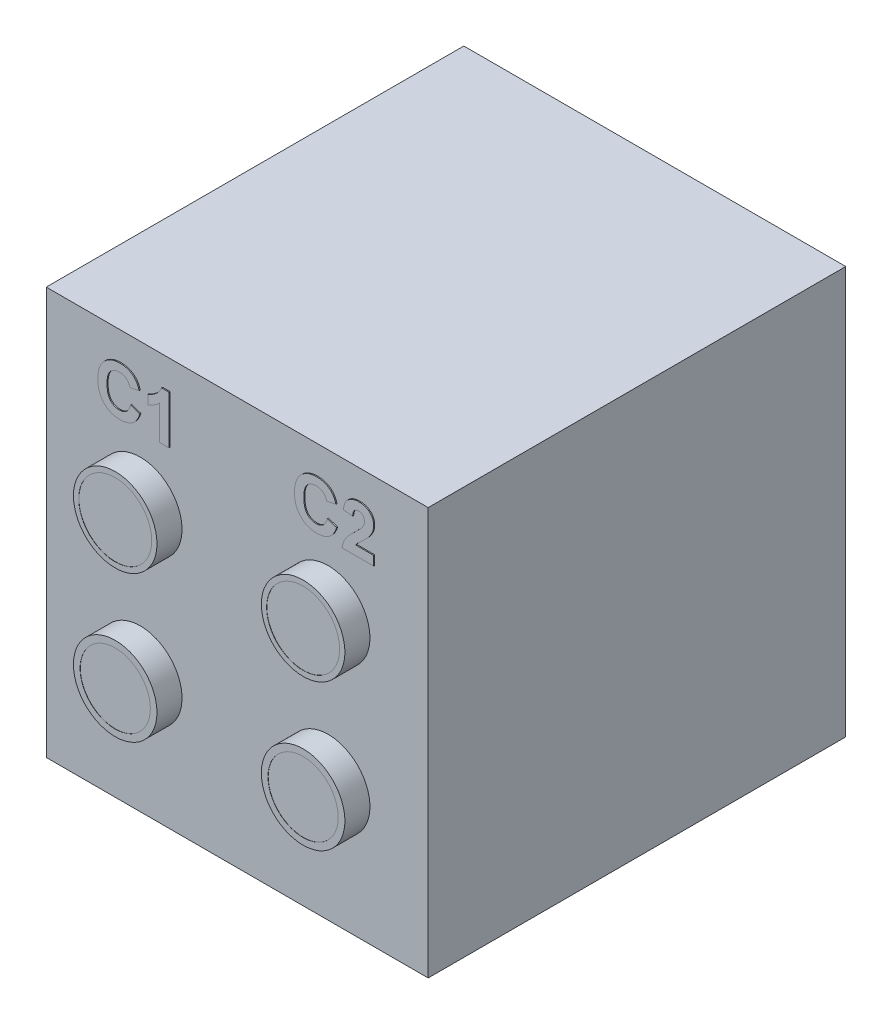
from build123d import *

# Parameters (mm, degrees)
CROQUIS1_W              = 400
CROQUIS1_H              = 500
SALIENTE_EXTRUIR1_DEPTH = 200
CROQUIS3_W              = 125
CROQUIS3_H              = 59
SALIENTE_EXTRUIR4_DEPTH = 30
REDONDEO1_R             = 6
REDONDEO2_R             = 3
CROQUIS4_R              = 10
SALIENTE_EXTRUIR5_DEPTH = 4
CHAFL_N1_SIZE           = 2
CROQUIS5_W              = 2.89106189
CROQUIS5_H              = 11.842268148
CORTAR_EXTRUIR1_DEPTH   = 0.1
CROQUIS6_R              = 20
SALIENTE_EXTRUIR6_DEPTH = 12
CROQUIS7_R              = 17.489444479
CROQUIS7_R_2            = 16.823196651
CORTAR_EXTRUIR2_DEPTH   = 0.1
CROQUIS8_W              = 125
CROQUIS8_H              = 59
SALIENTE_EXTRUIR7_DEPTH = 30
REDONDEO3_R             = 5
REDONDEO4_R             = 4
CROQUIS9_W              = 150.812994439
CROQUIS9_H              = 65.62344028
CORTAR_EXTRUIR3_DEPTH   = 30
CROQUIS10_W             = 177.8
CROQUIS10_H             = 100
SALIENTE_EXTRUIR8_DEPTH = 5
REDONDEO5_R             = 3
REDONDEO6_R             = 0.5
CROQUIS11_W             = 145.330042606
CROQUIS11_H             = 77.93999432
CORTAR_EXTRUIR4_DEPTH   = 2
CROQUIS12_W             = 154.511200307
CROQUIS12_H             = 64.586559633
CORTAR_EXTRUIR5_DEPTH   = 30
SALIENTE_EXTRUIR9_DEPTH = 0.5
CROQUIS15_W             = 743.222851548
CROQUIS15_H             = 911.06047989
CROQUIS15_W_2           = 182.932987454
CROQUIS15_H_2           = 195.128519951
CORTAR_EXTRUIR6_DEPTH   = 300


with BuildPart() as part:
    # Croquis1 → Saliente-Extruir1 (new body)
    with BuildSketch(Plane.XY):
        with Locations((200, 250)):
            Rectangle(CROQUIS1_W, CROQUIS1_H)
    extrude(amount=SALIENTE_EXTRUIR1_DEPTH)

    # Croquis3 → Saliente-Extruir4 (add)
    with BuildSketch(Plane.XY.offset(200)):
        with Locations((200, 470)):
            Rectangle(CROQUIS3_W, CROQUIS3_H)
    extrude(amount=SALIENTE_EXTRUIR4_DEPTH)

    # Redondeo1
    redondeo1_edges = [part.edges().sort_by_distance(p)[0] for p in [
        (262.5, 470, 230),
        (200, 499.5, 230),
        (137.5, 470, 230),
        (200, 440.5, 230),
    ]]
    fillet(redondeo1_edges, radius=REDONDEO1_R)

    # Redondeo2
    redondeo2_edges = [part.edges().sort_by_distance(p)[0] for p in [
        (262.5, 440.5, 212),
        (137.5, 440.5, 212),
        (262.5, 499.5, 212),
        (137.5, 499.5, 212),
        (139.623706555, 497.376293445, 228.579776101),
        (260.376293445, 497.376293445, 228.579776101),
        (139.623706555, 442.623706555, 228.579776101),
        (260.376293445, 442.623706555, 228.579776101),
    ]]
    fillet(redondeo2_edges, radius=REDONDEO2_R)

    # Croquis4 → Saliente-Extruir5 (add)
    with BuildSketch(Plane.XY.offset(200)):
        with Locations((25, 250)):
            Circle(CROQUIS4_R)
    extrude(amount=SALIENTE_EXTRUIR5_DEPTH)

    # Chaflán1
    chafl_n1_edges = [part.edges().sort_by_distance(p)[0] for p in [
        (15, 250, 204),
    ]]
    chamfer(chafl_n1_edges, length=CHAFL_N1_SIZE)

    # Croquis5 → Cortar-Extruir1 (cut)
    with BuildSketch(Plane.XY.offset(204)):
        with Locations((25, 250)):
            Rectangle(CROQUIS5_W, CROQUIS5_H)
    extrude(amount=-CORTAR_EXTRUIR1_DEPTH, mode=Mode.SUBTRACT)

    # Croquis6 → Saliente-Extruir6 (add)
    with BuildSketch(Plane.XY.offset(200)):
        with Locations(Location((66.83774854, 164.048551202, 0), (0, 0, 180))):
            Circle(CROQUIS6_R)
        with Locations(Location((66.83774854, 94.048551202, 0), (0, 0, 180))):
            Circle(CROQUIS6_R)
        with Locations(Location((156.83774854, 94.048551202, 0), (0, 0, 180))):
            Circle(CROQUIS6_R)
        with Locations(Location((156.83774854, 164.048551202, 0), (0, 0, 180))):
            Circle(CROQUIS6_R)
    extrude(amount=SALIENTE_EXTRUIR6_DEPTH)

    # Croquis7 → Cortar-Extruir2 (cut)
    with BuildSketch(Plane.XY.offset(212)):
        with Locations((66.83774854, 164.048551202)):
            Circle(CROQUIS7_R)
        with Locations((66.83774854, 94.048551202)):
            Circle(CROQUIS7_R_2)
        with Locations(Location((156.83774854, 94.048551202, 0), (0, 0, 180))):
            Circle(CROQUIS7_R_2)
        with Locations(Location((156.83774854, 164.048551202, 0), (0, 0, 180))):
            Circle(CROQUIS7_R)
    extrude(amount=-CORTAR_EXTRUIR2_DEPTH, mode=Mode.SUBTRACT)

    # Croquis8 → Saliente-Extruir7 (add)
    with BuildSketch(Plane.ZY):
        with Locations((100, 470)):
            Rectangle(CROQUIS8_W, CROQUIS8_H)
    extrude(amount=SALIENTE_EXTRUIR7_DEPTH)

    # Redondeo3
    redondeo3_edges = [part.edges().sort_by_distance(p)[0] for p in [
        (-30, 470, 162.5),
        (-30, 499.5, 100),
        (-30, 470, 37.5),
        (-30, 440.5, 100),
    ]]
    fillet(redondeo3_edges, radius=REDONDEO3_R)

    # Redondeo4
    redondeo4_edges = [part.edges().sort_by_distance(p)[0] for p in [
        (-12.5, 440.5, 162.5),
        (-12.5, 440.5, 37.5),
        (-12.5, 499.5, 162.5),
        (-12.5, 499.5, 37.5),
        (-28.816480084, 497.730244537, 39.269755463),
        (-28.816480084, 497.730244537, 160.730244537),
        (-28.816480084, 442.269755463, 39.269755463),
        (-28.816480084, 442.269755463, 160.730244537),
    ]]
    fillet(redondeo4_edges, radius=REDONDEO4_R)

    # Croquis9 → Cortar-Extruir3 (cut)
    with BuildSketch(Plane.XY.offset(230)):
        with Locations((199.746817996, 467.18827986)):
            Rectangle(CROQUIS9_W, CROQUIS9_H)
    extrude(amount=-CORTAR_EXTRUIR3_DEPTH, mode=Mode.SUBTRACT)

    # Croquis10 → Saliente-Extruir8 (add)
    with BuildSketch(Plane.XY.offset(200)):
        with Locations((261.1, 370)):
            Rectangle(CROQUIS10_W, CROQUIS10_H)
    extrude(amount=SALIENTE_EXTRUIR8_DEPTH)

    # Redondeo5
    redondeo5_edges = [part.edges().sort_by_distance(p)[0] for p in [
        (172.2, 420, 202.5),
        (172.2, 320, 202.5),
        (350, 320, 202.5),
        (350, 420, 202.5),
    ]]
    fillet(redondeo5_edges, radius=REDONDEO5_R)

    # Redondeo6
    redondeo6_edges = [part.edges().sort_by_distance(p)[0] for p in [
        (350, 370, 205),
        (261.1, 320, 205),
        (172.2, 370, 205),
        (261.1, 420, 205),
        (173.078679656, 419.121320344, 205),
        (173.078679656, 320.878679656, 205),
        (349.121320344, 419.121320344, 205),
        (349.121320344, 320.878679656, 205),
    ]]
    fillet(redondeo6_edges, radius=REDONDEO6_R)

    # Croquis11 → Cortar-Extruir4 (cut)
    with BuildSketch(Plane.XY.offset(205)):
        with Locations((261.1, 370)):
            Rectangle(CROQUIS11_W, CROQUIS11_H)
    extrude(amount=-CORTAR_EXTRUIR4_DEPTH, mode=Mode.SUBTRACT)

    # Croquis12 → Cortar-Extruir5 (cut)
    with BuildSketch(Plane.ZY.offset(30)):
        with Locations((101.786058174, 467.706720184)):
            Rectangle(CROQUIS12_W, CROQUIS12_H)
    extrude(amount=-CORTAR_EXTRUIR5_DEPTH, mode=Mode.SUBTRACT)

    # Croquis14 → Saliente-Extruir9 (add)
    with BuildSketch(Plane.XY.offset(200)):
        with BuildLine():
            Line((62.676778585, 203.812745701), (67.12194554, 202.331023382))
            add(Edge.make_bspline(
                [(67.12194554, 202.331023382), (67.031606065, 202.039564983), (66.854692956, 201.468797751), (66.529850829, 200.65075278), (66.158398895, 199.892633211), (65.753695386, 199.185565757), (65.290572591, 198.547816261), (64.794958583, 197.958269219), (64.25211678, 197.429341617), (63.664725712, 196.959904), (63.038439348, 196.544770101), (62.365982703, 196.193819856), (61.657391242, 195.891555504), (60.905479447, 195.646657651), (60.11523751, 195.450531644), (59.282957564, 195.32098935), (58.412532929, 195.233155396), (57.818194482, 195.223632057), (57.513902383, 195.218756255)],
                knots=[0, 0, 0, 0, 1.126640671, 2.206316847, 3.246446654, 4.24268115, 5.210795778, 6.153057602, 7.084219323, 8.004711971, 8.926421631, 9.854560063, 10.802134612, 11.768317461, 12.772025444, 13.805668576, 14.876536225, 16, 16, 16, 16], degree=3))
            add(Edge.make_bspline(
                [(57.513902383, 195.218756255), (57.138315965, 195.226522568), (56.39952625, 195.241799136), (55.319116268, 195.395578895), (54.289534407, 195.63551199), (53.309307786, 195.967695186), (52.384979279, 196.407670986), (51.508115862, 196.93734481), (50.685099031, 197.567469897), (49.918816065, 198.287426209), (49.222629464, 199.091717663), (48.620608156, 199.975998097), (48.106201766, 200.927810146), (47.690432, 201.951692163), (47.365328098, 203.046592798), (47.137592141, 204.210998176), (46.995089461, 205.445275086), (46.978854243, 206.291141154), (46.970522012, 206.725256132)],
                knots=[0, 0, 0, 0, 1.025049111, 2.016302254, 2.973197159, 3.90886983, 4.83646737, 5.763135642, 6.70136783, 7.661478232, 8.629732022, 9.600038443, 10.576877021, 11.5787097, 12.612181225, 13.690866959, 14.814907849, 16, 16, 16, 16], degree=3))
            add(Edge.make_bspline(
                [(46.970522012, 206.725256132), (46.978816686, 207.182516941), (46.994998081, 208.074549345), (47.137767723, 209.371488092), (47.359409088, 210.593777254), (47.68506246, 211.733838151), (48.094722426, 212.799694139), (48.609753359, 213.780764547), (49.205769523, 214.690129724), (49.898796493, 215.511122125), (50.668571701, 216.240052361), (51.493481044, 216.884623754), (52.381220187, 217.425372939), (53.326931221, 217.867569327), (54.331882511, 218.209762654), (55.394096587, 218.456168709), (56.514442527, 218.599592877), (57.280428607, 218.619705023), (57.671335379, 218.629968883)],
                knots=[0, 0, 0, 0, 1.212648312, 2.365655595, 3.457000981, 4.504219827, 5.506356588, 6.480637568, 7.437950897, 8.385265166, 9.323599949, 10.245787653, 11.157260172, 12.074946661, 13.00980897, 13.968233668, 14.963125779, 16, 16, 16, 16], degree=3))
            add(Edge.make_bspline(
                [(57.671335379, 218.629968883), (58.012729369, 218.62136664), (58.682077718, 218.604500797), (59.662270407, 218.489913642), (60.591218768, 218.288820835), (61.473944067, 218.017390262), (62.305421347, 217.659174112), (63.087140196, 217.221437665), (63.821787572, 216.706496998), (64.26442774, 216.304267347), (64.487258043, 216.101780177)],
                knots=[0, 0, 0, 0, 1.098510076, 2.153775193, 3.169777012, 4.153122333, 5.120892526, 6.076995459, 7.031936742, 8, 8, 8, 8], degree=3))
            add(Edge.make_bspline(
                [(64.487258043, 216.101780177), (64.616407561, 215.972935535), (64.877740225, 215.712219784), (65.226692682, 215.272057722), (65.557542963, 214.798223188), (65.865039813, 214.282633169), (66.139464605, 213.72139135), (66.394022911, 213.123116617), (66.628385193, 212.485502824), (66.758717573, 212.041763021), (66.825601076, 211.814046219)],
                knots=[0, 0, 0, 0, 0.885292881, 1.791380647, 2.722937556, 3.69093542, 4.703306561, 5.754477758, 6.847650944, 8, 8, 8, 8], degree=3))
            Line((66.825601076, 211.814046219), (62.380434121, 210.925012828))
            add(Edge.make_bspline(
                [(62.380434121, 210.925012828), (62.34265203, 211.070814562), (62.268231221, 211.358005725), (62.117650843, 211.770683654), (61.944923276, 212.162278152), (61.730843276, 212.523197703), (61.503434958, 212.869498601), (61.23419634, 213.185804011), (60.940321951, 213.480403605), (60.619694763, 213.750240154), (60.276137111, 213.989861194), (59.9162637, 214.205265586), (59.533533682, 214.381102877), (59.133038309, 214.523354833), (58.71637272, 214.642622381), (58.279827314, 214.716299503), (57.827151504, 214.772859722), (57.518727437, 214.775924517), (57.361099768, 214.777490855)],
                knots=[0, 0, 0, 0, 1.051226935, 2.070641259, 3.064374968, 4.034983734, 4.997599858, 5.953980297, 6.92954377, 7.901109626, 8.875958313, 9.851998019, 10.826131395, 11.811470594, 12.818270757, 13.847890818, 14.900111925, 16, 16, 16, 16], degree=3))
            add(Edge.make_bspline(
                [(57.361099768, 214.777490855), (57.144627398, 214.7731191), (56.722138103, 214.764586742), (56.104605268, 214.669456724), (55.516026291, 214.536692941), (54.958774875, 214.33396333), (54.436301936, 214.074673834), (53.942669536, 213.759478458), (53.480586993, 213.389727259), (53.049898132, 212.961039905), (52.663413419, 212.465665517), (52.32363819, 211.902581323), (52.04176418, 211.2653945), (51.812927309, 210.56035785), (51.632806623, 209.785794795), (51.504186272, 208.940711909), (51.433055352, 208.024531078), (51.421602676, 207.390607242), (51.415688967, 207.063274036)],
                knots=[0, 0, 0, 0, 0.938194206, 1.831074359, 2.704771284, 3.551924377, 4.396294915, 5.230222094, 6.087631332, 6.958733431, 7.860107878, 8.806247581, 9.804197948, 10.875520245, 12.017191412, 13.250061517, 14.580040491, 16, 16, 16, 16], degree=3))
            add(Edge.make_bspline(
                [(51.415688967, 207.063274036), (51.421544445, 206.71588301), (51.43282705, 206.046514012), (51.503942879, 205.081011143), (51.633385697, 204.193003924), (51.811112584, 203.380916456), (52.041102647, 202.645246149), (52.322499979, 201.987266071), (52.657027706, 201.40620565), (53.044165371, 200.902451804), (53.474125473, 200.469728804), (53.935262867, 200.097685545), (54.424856935, 199.779590027), (54.945853836, 199.517881543), (55.500235163, 199.319901988), (56.083444718, 199.176323743), (56.697622393, 199.085048771), (57.118449267, 199.075903651), (57.333317475, 199.071234282)],
                knots=[0, 0, 0, 0, 1.475208372, 2.842499301, 4.107722225, 5.282836115, 6.369007568, 7.375918121, 8.315702116, 9.208439171, 10.065831443, 10.90006451, 11.71996243, 12.54067204, 13.369972975, 14.214060185, 15.088124569, 16, 16, 16, 16], degree=3))
            add(Edge.make_bspline(
                [(57.333317475, 199.071234282), (57.492398058, 199.075203091), (57.805206406, 199.083007165), (58.267561262, 199.132539025), (58.711327629, 199.227063438), (59.138677604, 199.352054867), (59.551271578, 199.508882238), (59.942816146, 199.710060218), (60.32101477, 199.94128443), (60.678020134, 200.212261488), (61.018612719, 200.516484974), (61.329253367, 200.868091502), (61.617398356, 201.258632765), (61.879392136, 201.690718755), (62.12398875, 202.160650975), (62.332092794, 202.67575122), (62.525960364, 203.227695229), (62.625627768, 203.614322661), (62.676778585, 203.812745701)],
                knots=[0, 0, 0, 0, 0.980177776, 1.927374078, 2.859849964, 3.771585772, 4.668674471, 5.574490016, 6.479656464, 7.396337719, 8.332153134, 9.288470092, 10.28125149, 11.318486971, 12.398724812, 13.541284404, 14.738150009, 16, 16, 16, 16], degree=3))
        make_face()
        with BuildLine():
            Line((81.050135331, 195.218756255), (76.604968376, 195.218756255))
            Line((76.604968376, 195.218756255), (76.604968376, 211.675134752))
            add(Edge.make_bspline(
                [(76.604968376, 211.675134752), (76.403489531, 211.470596138), (76.003265116, 211.064293697), (75.364043677, 210.497555969), (74.700434368, 209.970340455), (74.005870166, 209.487654741), (73.289430799, 209.042621402), (72.543794663, 208.638751931), (71.774366386, 208.270458218), (71.241350104, 208.06463924), (70.974423567, 207.961568192)],
                knots=[0, 0, 0, 0, 1.012567276, 2.011397996, 3.011400399, 4.000747768, 4.993445519, 5.985067596, 6.990952157, 8, 8, 8, 8], degree=3))
            Line((70.974423567, 207.961568192), (70.974423567, 212.406735146))
            add(Edge.make_bspline(
                [(70.974423567, 212.406735146), (71.270458535, 212.517735556), (71.890036693, 212.750050777), (72.804325695, 213.244197029), (73.758636923, 213.855999945), (74.56031283, 214.456036922), (75.196810545, 214.989517748), (75.641674058, 215.418352623), (76.053865682, 215.85750178), (76.417891952, 216.321139343), (76.743308732, 216.799891585), (77.031642186, 217.292976379), (77.285441906, 217.80195135), (77.418304284, 218.156390229), (77.484741003, 218.333624419)],
                knots=[0, 0, 0, 0, 1.253673617, 2.623841347, 4.114270668, 5.751233548, 6.594491912, 7.409089316, 8.202422231, 8.983165545, 9.746111525, 10.498431446, 11.249153235, 12, 12, 12, 12], degree=3))
            Line((77.484741003, 218.333624419), (81.050135331, 218.333624419))
            Line((81.050135331, 218.333624419), (81.050135331, 195.218756255))
        make_face()
        with BuildLine():
            Line((156.914318023, 203.812745701), (161.359484978, 202.331023382))
            add(Edge.make_bspline(
                [(161.359484978, 202.331023382), (161.269145503, 202.039564983), (161.092232394, 201.468797751), (160.767390267, 200.65075278), (160.395938333, 199.892633211), (159.991234824, 199.185565757), (159.52811203, 198.547816261), (159.032498021, 197.958269219), (158.489656218, 197.429341617), (157.90226515, 196.959904), (157.275978786, 196.544770101), (156.603522141, 196.193819856), (155.89493068, 195.891555504), (155.143018885, 195.646657651), (154.352776948, 195.450531644), (153.520497002, 195.32098935), (152.650072367, 195.233155396), (152.05573392, 195.223632057), (151.751441821, 195.218756255)],
                knots=[0, 0, 0, 0, 1.126640671, 2.206316847, 3.246446654, 4.24268115, 5.210795778, 6.153057602, 7.084219323, 8.004711971, 8.926421631, 9.854560063, 10.802134612, 11.768317461, 12.772025444, 13.805668576, 14.876536225, 16, 16, 16, 16], degree=3))
            add(Edge.make_bspline(
                [(151.751441821, 195.218756255), (151.375855403, 195.226522568), (150.637065688, 195.241799136), (149.556655706, 195.395578895), (148.527073845, 195.63551199), (147.546847224, 195.967695186), (146.622518717, 196.407670986), (145.7456553, 196.93734481), (144.922638469, 197.567469897), (144.156355503, 198.287426209), (143.460168902, 199.091717663), (142.858147594, 199.975998097), (142.343741205, 200.927810146), (141.927971438, 201.951692163), (141.602867537, 203.046592798), (141.375131579, 204.210998176), (141.232628899, 205.445275086), (141.216393681, 206.291141154), (141.20806145, 206.725256132)],
                knots=[0, 0, 0, 0, 1.025049111, 2.016302254, 2.973197159, 3.90886983, 4.83646737, 5.763135642, 6.70136783, 7.661478232, 8.629732022, 9.600038443, 10.576877021, 11.5787097, 12.612181225, 13.690866959, 14.814907849, 16, 16, 16, 16], degree=3))
            add(Edge.make_bspline(
                [(141.20806145, 206.725256132), (141.216356124, 207.182516941), (141.232537519, 208.074549345), (141.375307161, 209.371488092), (141.596948526, 210.593777254), (141.922601898, 211.733838151), (142.332261864, 212.799694139), (142.847292797, 213.780764547), (143.443308961, 214.690129724), (144.136335931, 215.511122125), (144.906111139, 216.240052361), (145.731020482, 216.884623754), (146.618759625, 217.425372939), (147.564470659, 217.867569327), (148.569421949, 218.209762654), (149.631636025, 218.456168709), (150.751981966, 218.599592877), (151.517968045, 218.619705023), (151.908874817, 218.629968883)],
                knots=[0, 0, 0, 0, 1.212648312, 2.365655595, 3.457000981, 4.504219827, 5.506356588, 6.480637568, 7.437950897, 8.385265166, 9.323599949, 10.245787653, 11.157260172, 12.074946661, 13.00980897, 13.968233668, 14.963125779, 16, 16, 16, 16], degree=3))
            add(Edge.make_bspline(
                [(151.908874817, 218.629968883), (152.250268807, 218.62136664), (152.919617157, 218.604500797), (153.899809846, 218.489913642), (154.828758206, 218.288820835), (155.711483505, 218.017390262), (156.542960785, 217.659174112), (157.324679634, 217.221437665), (158.05932701, 216.706496998), (158.501967178, 216.304267347), (158.724797481, 216.101780177)],
                knots=[0, 0, 0, 0, 1.098510076, 2.153775193, 3.169777012, 4.153122333, 5.120892526, 6.076995459, 7.031936742, 8, 8, 8, 8], degree=3))
            add(Edge.make_bspline(
                [(158.724797481, 216.101780177), (158.853946999, 215.972935535), (159.115279663, 215.712219784), (159.46423212, 215.272057722), (159.795082401, 214.798223188), (160.102579251, 214.282633169), (160.377004043, 213.72139135), (160.631562349, 213.123116617), (160.865924632, 212.485502824), (160.996257011, 212.041763021), (161.063140514, 211.814046219)],
                knots=[0, 0, 0, 0, 0.885292881, 1.791380647, 2.722937556, 3.69093542, 4.703306561, 5.754477758, 6.847650944, 8, 8, 8, 8], degree=3))
            Line((161.063140514, 211.814046219), (156.617973559, 210.925012828))
            add(Edge.make_bspline(
                [(156.617973559, 210.925012828), (156.580191468, 211.070814562), (156.505770659, 211.358005725), (156.355190281, 211.770683654), (156.182462714, 212.162278152), (155.968382714, 212.523197703), (155.740974396, 212.869498601), (155.471735779, 213.185804011), (155.177861389, 213.480403605), (154.857234201, 213.750240154), (154.513676549, 213.989861194), (154.153803138, 214.205265586), (153.77107312, 214.381102877), (153.370577747, 214.523354833), (152.953912158, 214.642622381), (152.517366752, 214.716299503), (152.064690942, 214.772859722), (151.756266875, 214.775924517), (151.598639207, 214.777490855)],
                knots=[0, 0, 0, 0, 1.051226935, 2.070641259, 3.064374968, 4.034983734, 4.997599858, 5.953980297, 6.92954377, 7.901109626, 8.875958313, 9.851998019, 10.826131395, 11.811470594, 12.818270757, 13.847890818, 14.900111925, 16, 16, 16, 16], degree=3))
            add(Edge.make_bspline(
                [(151.598639207, 214.777490855), (151.382166836, 214.7731191), (150.959677542, 214.764586742), (150.342144706, 214.669456724), (149.753565729, 214.536692941), (149.196314313, 214.33396333), (148.673841374, 214.074673834), (148.180208974, 213.759478458), (147.718126431, 213.389727259), (147.28743757, 212.961039905), (146.900952857, 212.465665517), (146.561177628, 211.902581323), (146.279303618, 211.2653945), (146.050466748, 210.56035785), (145.870346061, 209.785794795), (145.74172571, 208.940711909), (145.67059479, 208.024531078), (145.659142114, 207.390607242), (145.653228405, 207.063274036)],
                knots=[0, 0, 0, 0, 0.938194206, 1.831074359, 2.704771284, 3.551924377, 4.396294915, 5.230222094, 6.087631332, 6.958733431, 7.860107878, 8.806247581, 9.804197948, 10.875520245, 12.017191412, 13.250061517, 14.580040491, 16, 16, 16, 16], degree=3))
            add(Edge.make_bspline(
                [(145.653228405, 207.063274036), (145.659083883, 206.71588301), (145.670366488, 206.046514012), (145.741482317, 205.081011143), (145.870925135, 204.193003924), (146.048652022, 203.380916456), (146.278642085, 202.645246149), (146.560039417, 201.987266071), (146.894567144, 201.40620565), (147.281704809, 200.902451804), (147.711664911, 200.469728804), (148.172802305, 200.097685545), (148.662396373, 199.779590027), (149.183393275, 199.517881543), (149.737774601, 199.319901988), (150.320984156, 199.176323743), (150.935161831, 199.085048771), (151.355988705, 199.075903651), (151.570856913, 199.071234282)],
                knots=[0, 0, 0, 0, 1.475208372, 2.842499301, 4.107722225, 5.282836115, 6.369007568, 7.375918121, 8.315702116, 9.208439171, 10.065831443, 10.90006451, 11.71996243, 12.54067204, 13.369972975, 14.214060185, 15.088124569, 16, 16, 16, 16], degree=3))
            add(Edge.make_bspline(
                [(151.570856913, 199.071234282), (151.729937496, 199.075203091), (152.042745844, 199.083007165), (152.505100701, 199.132539025), (152.948867067, 199.227063438), (153.376217042, 199.352054867), (153.788811017, 199.508882238), (154.180355584, 199.710060218), (154.558554208, 199.94128443), (154.915559572, 200.212261488), (155.256152157, 200.516484974), (155.566792805, 200.868091502), (155.854937794, 201.258632765), (156.116931574, 201.690718755), (156.361528188, 202.160650975), (156.569632232, 202.67575122), (156.763499802, 203.227695229), (156.863167206, 203.614322661), (156.914318023, 203.812745701)],
                knots=[0, 0, 0, 0, 0.980177776, 1.927374078, 2.859849964, 3.771585772, 4.668674471, 5.574490016, 6.479656464, 7.396337719, 8.332153134, 9.288470092, 10.28125149, 11.318486971, 12.398724812, 13.541284404, 14.738150009, 16, 16, 16, 16], degree=3))
        make_face()
        with BuildLine():
            Line((179.140152796, 199.66392321), (179.140152796, 195.218756255))
            Line((179.140152796, 195.218756255), (164.026585151, 195.218756255))
            add(Edge.make_bspline(
                [(164.026585151, 195.218756255), (164.077756189, 195.598660267), (164.180069573, 196.358255272), (164.496385979, 197.467832386), (164.918560031, 198.550590072), (165.376749776, 199.431692011), (165.832470229, 200.140948753), (166.245945421, 200.722119208), (166.739206143, 201.340459626), (167.305094649, 202.000961729), (167.940483607, 202.705690234), (168.650113428, 203.452025109), (169.437369156, 204.236393442), (169.991217583, 204.769018135), (170.27760118, 205.044427378)],
                knots=[0, 0, 0, 0, 1.156289446, 2.311930546, 3.473459201, 4.661751613, 5.303057008, 6.018253237, 6.81459331, 7.690699809, 8.644447906, 9.679642995, 10.800191253, 12, 12, 12, 12], degree=3))
            add(Edge.make_bspline(
                [(170.27760118, 205.044427378), (170.506138567, 205.265028524), (170.941206442, 205.684988134), (171.560743939, 206.286353274), (172.105381239, 206.839178771), (172.586505954, 207.329138546), (172.993003421, 207.768708214), (173.330220742, 208.150984403), (173.602428733, 208.47752386), (173.749856818, 208.684680695), (173.815213215, 208.776515467)],
                knots=[0, 0, 0, 0, 1.480720495, 2.818855715, 4.024636094, 5.098235712, 6.019786162, 6.815086302, 7.474715479, 8, 8, 8, 8], degree=3))
            add(Edge.make_bspline(
                [(173.815213215, 208.776515467), (173.949047166, 208.998827956), (174.20719735, 209.427642989), (174.490280443, 210.101962385), (174.660197468, 210.77614249), (174.683514681, 211.226625779), (174.694985842, 211.448246022)],
                knots=[0, 0, 0, 0, 1.0911822, 2.104764037, 3.067617678, 4, 4, 4, 4], degree=3))
            add(Edge.make_bspline(
                [(174.694985842, 211.448246022), (174.686660637, 211.678871681), (174.67091, 212.115197441), (174.538838186, 212.730933771), (174.304630255, 213.260246374), (173.982169035, 213.704759984), (173.574416175, 214.053034697), (173.097741225, 214.310375903), (172.545166428, 214.45265205), (172.156784262, 214.471365804), (171.953799553, 214.481146392)],
                knots=[0, 0, 0, 0, 1.193122327, 2.257294386, 3.237245624, 4.168877528, 5.075331632, 5.990371598, 6.949684428, 8, 8, 8, 8], degree=3))
            add(Edge.make_bspline(
                [(171.953799553, 214.481146392), (171.752186191, 214.472012054), (171.362712704, 214.454366485), (170.809186375, 214.300217214), (170.324952998, 214.03336861), (169.979862539, 213.729268884), (169.746737565, 213.433553988), (169.587894341, 213.175857936), (169.450983882, 212.883036195), (169.329669793, 212.558385447), (169.233845377, 212.198186478), (169.156674344, 211.805182565), (169.094485656, 211.377258789), (169.074708555, 211.079564465), (169.064441032, 210.925012828)],
                knots=[0, 0, 0, 0, 1.402788338, 2.709884207, 3.961032948, 5.225417836, 5.883680772, 6.578928686, 7.329201998, 8.132101139, 8.990263233, 9.922304639, 10.921339128, 12, 12, 12, 12], degree=3))
            Line((169.064441032, 210.925012828), (164.619274078, 211.360268759))
            add(Edge.make_bspline(
                [(164.619274078, 211.360268759), (164.655012532, 211.660373557), (164.724303684, 212.24222881), (164.897220915, 213.077973574), (165.11621418, 213.848985844), (165.391723627, 214.553834761), (165.712362116, 215.197002479), (166.094484878, 215.768837867), (166.524740138, 216.275675242), (167.003499735, 216.717244856), (167.527720037, 217.094951456), (168.077795182, 217.432112556), (168.664475175, 217.708691838), (169.281300651, 217.93663472), (169.927992855, 218.118804849), (170.607542825, 218.239253268), (171.315756633, 218.323977149), (171.799186334, 218.330360196), (172.046407198, 218.333624419)],
                knots=[0, 0, 0, 0, 1.270971563, 2.464210789, 3.586263665, 4.638946707, 5.643716971, 6.603612468, 7.52484387, 8.434700188, 9.336036235, 10.239171475, 11.145359471, 12.059630629, 13.003312604, 13.96741569, 14.960557767, 16, 16, 16, 16], degree=3))
            add(Edge.make_bspline(
                [(172.046407198, 218.333624419), (172.315168216, 218.328458972), (172.838614045, 218.318398615), (173.602752028, 218.235320108), (174.32060476, 218.090460693), (174.998448214, 217.898573896), (175.629321299, 217.642390992), (176.218481058, 217.332676513), (176.756655149, 216.957676168), (177.251865786, 216.537840321), (177.694544473, 216.076157016), (178.082290947, 215.583693718), (178.407143665, 215.060793523), (178.679744983, 214.513830005), (178.882149622, 213.934001731), (179.029630443, 213.329326136), (179.127416167, 212.696982279), (179.135860299, 212.265105769), (179.140152796, 212.045565331)],
                knots=[0, 0, 0, 0, 1.210756838, 2.35810096, 3.457354827, 4.507168606, 5.527358126, 6.519769748, 7.499700793, 8.476517721, 9.440526811, 10.376769937, 11.295256217, 12.209626307, 13.124630862, 14.055668209, 15.011616881, 16, 16, 16, 16], degree=3))
            add(Edge.make_bspline(
                [(179.140152796, 212.045565331), (179.134497489, 211.79360266), (179.123278226, 211.293747386), (179.015862112, 210.554811958), (178.851751202, 209.832916287), (178.609208199, 209.126296129), (178.301766114, 208.418001303), (177.905465895, 207.706441979), (177.445331368, 206.97015879), (177.08506417, 206.49411958), (176.89904779, 206.248326761)],
                knots=[0, 0, 0, 0, 0.953409949, 1.89141903, 2.821310783, 3.752688675, 4.715703262, 5.740811754, 6.833515735, 8, 8, 8, 8], degree=3))
            add(Edge.make_bspline(
                [(176.89904779, 206.248326761), (176.828741765, 206.159776115), (176.678162556, 205.970121156), (176.421987752, 205.679314605), (176.125103188, 205.361662178), (175.791702227, 205.011218155), (175.410771983, 204.640392717), (174.996018347, 204.233678232), (174.529190952, 203.811879498), (174.045670894, 203.364474686), (173.560049127, 202.929021874), (173.11369271, 202.515438242), (172.708252561, 202.149505555), (172.362610788, 201.811022651), (172.056436828, 201.523090745), (171.800766205, 201.270945023), (171.590814717, 201.060689726), (171.301515078, 200.732955062), (170.933414118, 200.289693792), (170.674440042, 199.866145114), (170.550793733, 199.66392321)],
                knots=[0, 0, 0, 0, 0.665555651, 1.425465941, 2.280616993, 3.225313414, 4.272635571, 5.410053715, 6.644756443, 7.976022804, 9.288331007, 10.484517221, 11.558462543, 12.503158964, 13.33222979, 14.032602617, 14.617328242, 15.080653724, 16.606167857, 18, 18, 18, 18], degree=3))
            Line((170.550793733, 199.66392321), (179.140152796, 199.66392321))
        make_face()
    extrude(amount=SALIENTE_EXTRUIR9_DEPTH)

    # Croquis15 → Cortar-Extruir6 (cut, symmetric)
    with BuildSketch(Plane.XY.offset(200)):
        with Locations((113.276213355, 134.48120607)):
            Rectangle(CROQUIS15_W, CROQUIS15_H)
        with Locations((113.276213355, 134.481206071)):
            Rectangle(CROQUIS15_W_2, CROQUIS15_H_2, mode=Mode.SUBTRACT)
    extrude(amount=CORTAR_EXTRUIR6_DEPTH, both=True, mode=Mode.SUBTRACT)


solid = part.part
